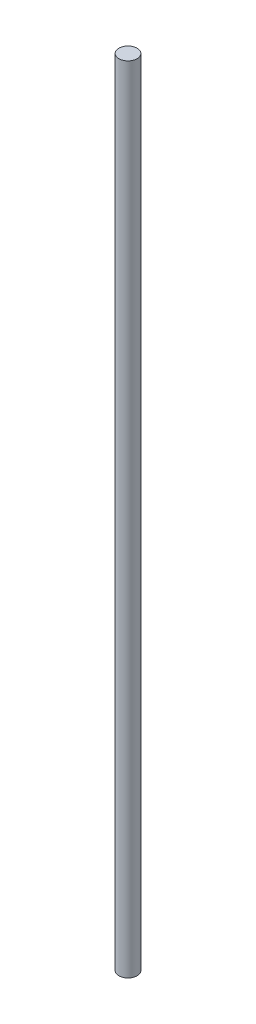
from build123d import *

# Parameters (mm, degrees)
SKETCH1_R           = 6
BOSS_EXTRUDE1_DEPTH = 523


with BuildPart() as part:
    # Sketch1 → Boss-Extrude1 (new body)
    with BuildSketch(Plane(origin=(0, 0, 0), x_dir=(1, 0, 0), z_dir=(0, 1, 0))):
        with Locations(Location((0, 0, 0), (0, 0, 270))):
            Circle(SKETCH1_R)
    extrude(amount=BOSS_EXTRUDE1_DEPTH)


solid = part.part
